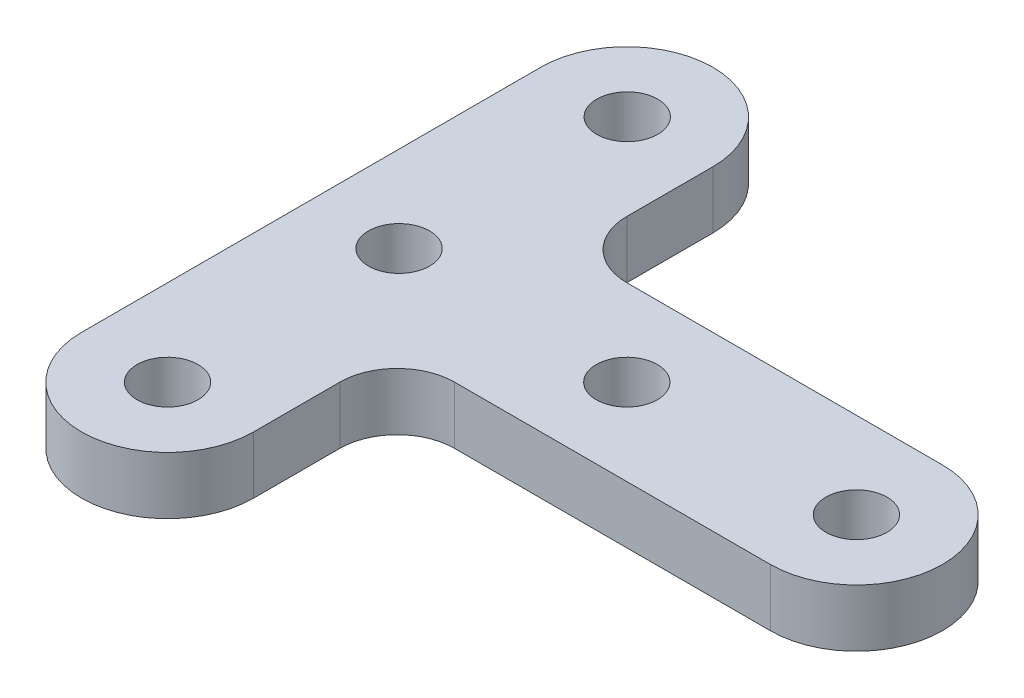
from build123d import *

# Parameters (mm, degrees)
BOSS_EXTRUDE1_START     = 12.827
BOSS_EXTRUDE1_DEPTH     = 6.35
F_1_4_CLEARANCE_HOLE1_D = 6.7564
FILLET1_R               = 6.35


with BuildPart() as part:
    # Sketch1 → Boss-Extrude1 (new body)
    with BuildSketch(Plane(origin=(0, 144.904574554, 0), x_dir=(-1, 0, 0), z_dir=(0, -1, 0)).offset(BOSS_EXTRUDE1_START)):
        with BuildLine():
            Line((-105.441812484, -1122.100334154), (-105.441812484, -1137.975334154))
            ThreePointArc((-105.441812484, -1137.975334154), (-114.966812484, -1147.500334154), (-124.491812484, -1137.975334154))
            Line((-124.491812484, -1137.975334154), (-124.491812484, -1087.175334154))
            ThreePointArc((-124.491812484, -1087.175334154), (-114.966812484, -1077.650334154), (-105.441812484, -1087.175334154))
            Line((-105.441812484, -1087.175334154), (-105.441812484, -1103.050334154))
            Line((-105.441812484, -1103.050334154), (-64.166812484, -1103.050334154))
            ThreePointArc((-64.166812484, -1103.050334154), (-54.641812484, -1112.575334154), (-64.166812484, -1122.100334154))
            Line((-64.166812484, -1122.100334154), (-105.441812484, -1122.100334154))
        make_face()
    extrude(amount=BOSS_EXTRUDE1_DEPTH)

    # 1/4 Clearance Hole1 (through all)
    with Locations(Plane(origin=(0, 125.727574554, 0), x_dir=(-1, 0, 0), z_dir=(0, -1, 0))):
        with Locations((-114.966812484, -1137.975334154), (-114.966812484, -1112.369211098), (-114.966812484, -1087.128841033), (-64.166812484, -1112.575334154), (-89.566812484, -1112.575334154)):
            Hole(F_1_4_CLEARANCE_HOLE1_D / 2)


with BuildPart() as body_2:
    # Mirror1: mirrored copy
    add(part.part.mirror(Plane(origin=(0, 0, 0), x_dir=(0, 0, 1), z_dir=(1, 0, 0))))

    # Fillet1
    fillet1_edges = [body_2.edges().sort_by_distance(p)[0] for p in [
        (-105.441812484, 128.902574554, 1122.100334154),
        (-105.441812484, 128.902574554, 1103.050334154),
    ]]
    fillet(fillet1_edges, radius=FILLET1_R)


solid = body_2.part
